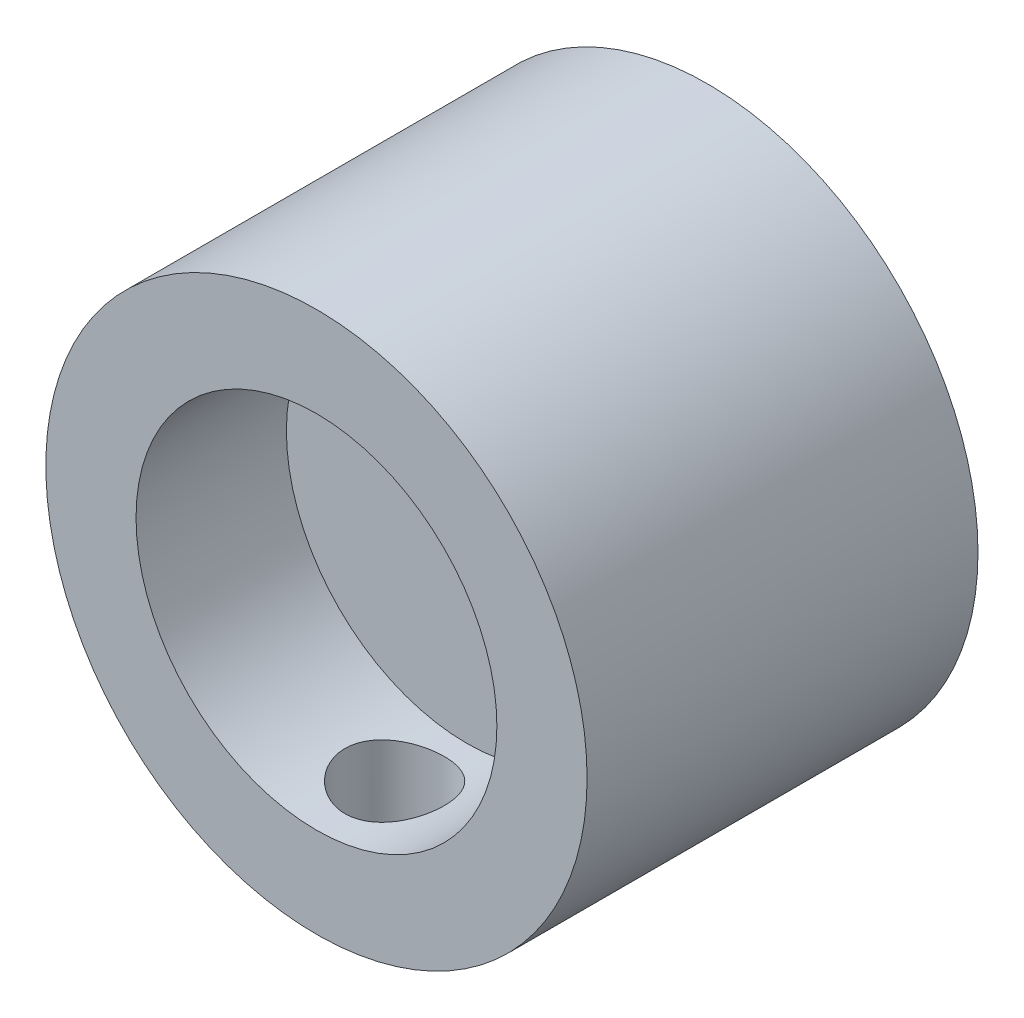
from build123d import *

# Parameters (mm, degrees)
SKETCH3_R               = 4.5
BOSS_EXTRUDE3_DEPTH     = 6.5
SKETCH4_R               = 3
CUT_EXTRUDE1_DEPTH      = 2.5
SKETCH5_R               = 2
CUT_EXTRUDE2_DEPTH      = 1.95
CUT_EXTRUDE3_REACH      = 11.097
CUT_EXTRUDE3_END_RADIUS = 4.5
SKETCH7_R               = 0.825


with BuildPart() as part:
    # Sketch3 → Boss-Extrude3 (new body)
    with BuildSketch(Plane.XY):
        with Locations(Location((0, 0, 0), (0, 0, 180))):
            Circle(SKETCH3_R)
    extrude(amount=BOSS_EXTRUDE3_DEPTH)

    # Sketch4 → Cut-Extrude1 (cut)
    with BuildSketch(Plane.XY.offset(6.5)):
        Circle(SKETCH4_R)
    extrude(amount=-CUT_EXTRUDE1_DEPTH, mode=Mode.SUBTRACT)

    # Sketch5 → Cut-Extrude2 (cut)
    with BuildSketch(Plane(origin=(0, 0, 0), x_dir=(-1, 0, 0), z_dir=(0, 0, -1))):
        Circle(SKETCH5_R)
    extrude(amount=-CUT_EXTRUDE2_DEPTH, mode=Mode.SUBTRACT)

    # Cut-Extrude3: up to this cylinder (the profile starts inside it)
    cut_extrude3_end = Plane(origin=(0, 0, 5.2), z_dir=(0, 0, -1)) * Cylinder(CUT_EXTRUDE3_END_RADIUS, 32.194, mode=Mode.PRIVATE)
    # Sketch7 → Cut-Extrude3 (cut, up to the surface)
    with BuildSketch(Plane(origin=(0, 0, 0), x_dir=(1, 0, 0), z_dir=(0, 1, 0)), mode=Mode.PRIVATE) as cut_extrude3_sk1:
        with Locations(Location((0, -5.2, 0), (0, 0, 270))):
            Circle(SKETCH7_R)
    cut_extrude3_tool1 = extrude(cut_extrude3_sk1.sketch, amount=-CUT_EXTRUDE3_REACH, mode=Mode.PRIVATE) & cut_extrude3_end
    add(cut_extrude3_tool1.solids().sort_by_distance((0, 0, 5.2))[0], mode=Mode.SUBTRACT)


solid = part.part
